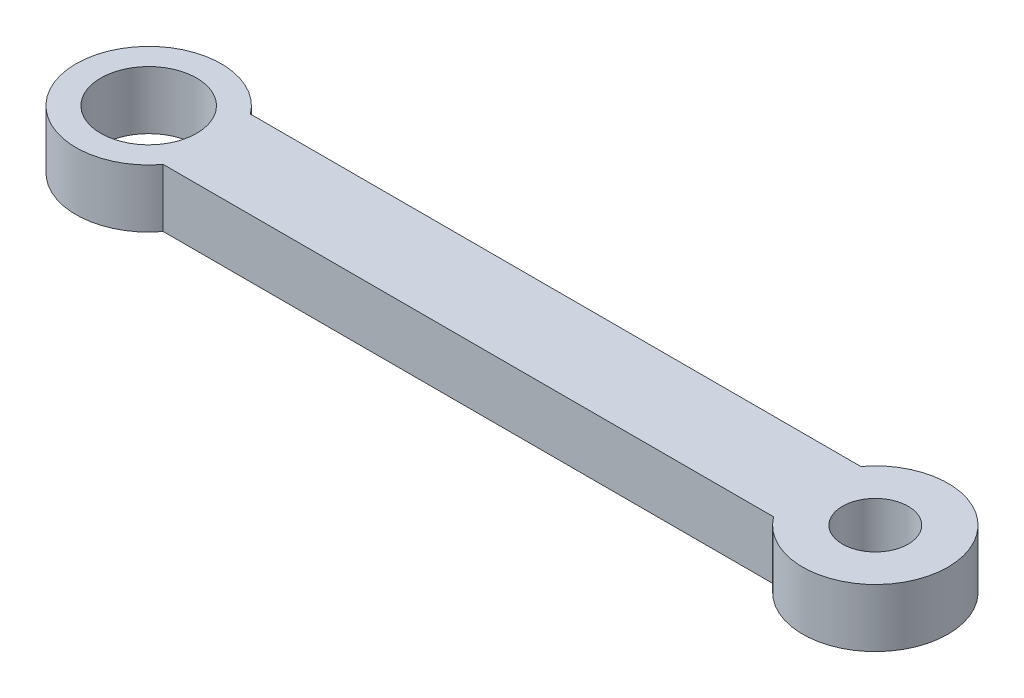
from build123d import *

# Parameters (mm, degrees)
SKETCH1_R           = 1.65
SKETCH1_R_2         = 1.1303
BOSS_EXTRUDE1_DEPTH = 2


with BuildPart() as part:
    # Sketch1 → Boss-Extrude1 (new body)
    with BuildSketch(Plane(origin=(0, 0, 0), x_dir=(1, 0, 0), z_dir=(0, 1, 0))):
        with BuildLine():
            Line((-10.5, 1.5), (10.5, 1.5))
            ThreePointArc((10.5, 1.5), (15, 0), (10.5, -1.5))
            Line((10.5, -1.5), (-10.5, -1.5))
            ThreePointArc((-10.5, -1.5), (-15, 0), (-10.5, 1.5))
        make_face()
        with Locations(Location((-12.5, 0, 0), (0, 0, 270))):
            Circle(SKETCH1_R, mode=Mode.SUBTRACT)
        with Locations(Location((12.5, 0, 0), (0, 0, 270))):
            Circle(SKETCH1_R_2, mode=Mode.SUBTRACT)
    extrude(amount=BOSS_EXTRUDE1_DEPTH)


solid = part.part
